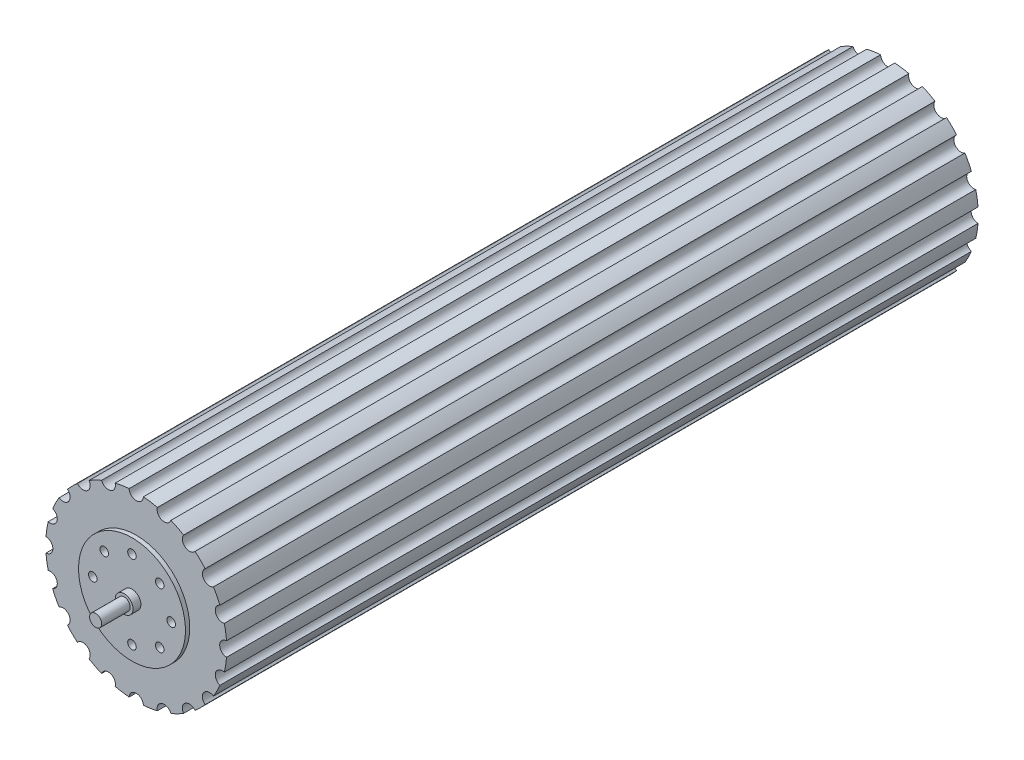
from build123d import *

# Parameters (mm, degrees)
SKETCH1_R               = 127
BOSS_EXTRUDE1_DEPTH     = 527
SKETCH4_R               = 12.5
BOSS_EXTRUDE3_DEPTH     = 584
BOSS_EXTRUDE4_START     = 6
SKETCH5_R               = 75
SKETCH5_R_2             = 12.5
BOSS_EXTRUDE4_DEPTH     = 6
CUT_EXTRUDE1_DEPTH      = 1132.347426744
CUT_EXTRUDE1_DEPTH_BACK = 1132.347426744
SKETCH6_R               = 6
CUT_EXTRUDE2_DEPTH      = 1126.42392013
CUT_EXTRUDE2_DEPTH_BACK = 1126.42392013
SKETCH7_R               = 10
SKETCH8_R               = 12.5
SKETCH8_R_2             = 8.5
CUT_EXTRUDE4_DEPTH      = 40
CUT_EXTRUDE5_START      = -40
SKETCH10_R              = 12.5
SKETCH10_R_2            = 8.5
CUT_EXTRUDE5_DEPTH      = 40


with BuildPart() as part:
    # Sketch1 → Boss-Extrude1 (new, symmetric)
    with BuildSketch(Plane.XY):
        Circle(SKETCH1_R)
    extrude(amount=BOSS_EXTRUDE1_DEPTH, both=True)

    # Sketch4 → Boss-Extrude3 (add, symmetric)
    with BuildSketch(Plane(origin=(0, 0, 0), x_dir=(-1, 0, 0), z_dir=(0, 0, -1))):
        with Locations(Location((0, 0, 0), (0, 0, 180))):
            Circle(SKETCH4_R)
    boss_extrude3 = extrude(amount=BOSS_EXTRUDE3_DEPTH, both=True)

    # Sketch5 → Boss-Extrude4 (add)
    with BuildSketch(Plane(origin=(0, 0, -527), x_dir=(-1, 0, 0), z_dir=(0, 0, -1)).offset(BOSS_EXTRUDE4_START)):
        with Locations(Location((0, 0, 0), (0, 0, 180))):
            Circle(SKETCH5_R)
        with Locations(Location((0, 0, 0), (0, 0, 180))):
            Circle(SKETCH5_R_2, mode=Mode.SUBTRACT)
    boss_extrude4 = extrude(amount=-BOSS_EXTRUDE4_DEPTH)

    # Mirror1: Boss-Extrude3, Boss-Extrude4 across plane
    add(boss_extrude3.mirror(Plane(origin=(0, 0, 0), x_dir=(1, 0, 0), z_dir=(0, 0, -1))))
    add(boss_extrude4.mirror(Plane(origin=(0, 0, 0), x_dir=(1, 0, 0), z_dir=(0, 0, -1))))

    # Sketch6 → Cut-Extrude1 (cut, two sides: drawn at the far end of the back side and taken through both)
    with BuildSketch(Plane(origin=(0, 0, -533), x_dir=(-1, 0, 0), z_dir=(0, 0, -1)).offset(-CUT_EXTRUDE1_DEPTH_BACK)):
        with Locations((0, 55)):
            Circle(SKETCH6_R)
        with Locations((38.890872965, 38.890872965)):
            Circle(SKETCH6_R)
        with Locations((55, 0)):
            Circle(SKETCH6_R)
        with Locations((38.890872965, -38.890872965)):
            Circle(SKETCH6_R)
        with Locations((0, -55)):
            Circle(SKETCH6_R)
        with Locations((-38.890872965, -38.890872965)):
            Circle(SKETCH6_R)
        with Locations((-55, 0)):
            Circle(SKETCH6_R)
        with Locations((-38.890872965, 38.890872965)):
            Circle(SKETCH6_R)
    extrude(amount=CUT_EXTRUDE1_DEPTH + CUT_EXTRUDE1_DEPTH_BACK, mode=Mode.SUBTRACT)

    # Sketch7 → Cut-Extrude2 (cut, two sides: drawn at the far end of the back side and taken through both)
    with BuildSketch(Plane(origin=(0, 0, -527), x_dir=(-1, 0, 0), z_dir=(0, 0, -1)).offset(-CUT_EXTRUDE2_DEPTH_BACK)):
        with Locations((0, 127)):
            Circle(SKETCH7_R)
        with Locations((39.245158286, 120.784177569)):
            Circle(SKETCH7_R)
        with Locations((74.648727041, 102.745158286)):
            Circle(SKETCH7_R)
        with Locations((102.745158286, 74.648727041)):
            Circle(SKETCH7_R)
        with Locations((120.784177569, 39.245158286)):
            Circle(SKETCH7_R)
        with Locations((127, 0)):
            Circle(SKETCH7_R)
        with Locations((120.784177569, -39.245158286)):
            Circle(SKETCH7_R)
        with Locations((102.745158286, -74.648727041)):
            Circle(SKETCH7_R)
        with Locations((74.648727041, -102.745158286)):
            Circle(SKETCH7_R)
        with Locations((39.245158286, -120.784177569)):
            Circle(SKETCH7_R)
        with Locations((0, -127)):
            Circle(SKETCH7_R)
        with Locations((-39.245158286, -120.784177569)):
            Circle(SKETCH7_R)
        with Locations((-74.648727041, -102.745158286)):
            Circle(SKETCH7_R)
        with Locations((-102.745158286, -74.648727041)):
            Circle(SKETCH7_R)
        with Locations((-120.784177569, -39.245158286)):
            Circle(SKETCH7_R)
        with Locations((-127, 0)):
            Circle(SKETCH7_R)
        with Locations((-120.784177569, 39.245158286)):
            Circle(SKETCH7_R)
        with Locations((-102.745158286, 74.648727041)):
            Circle(SKETCH7_R)
        with Locations((-74.648727041, 102.745158286)):
            Circle(SKETCH7_R)
        with Locations((-39.245158286, 120.784177569)):
            Circle(SKETCH7_R)
    extrude(amount=CUT_EXTRUDE2_DEPTH + CUT_EXTRUDE2_DEPTH_BACK, mode=Mode.SUBTRACT)

    # Sketch8 → Cut-Extrude4 (cut)
    with BuildSketch(Plane(origin=(0, 0, -584), x_dir=(-1, 0, 0), z_dir=(0, 0, -1))):
        Circle(SKETCH8_R)
        Circle(SKETCH8_R_2, mode=Mode.SUBTRACT)
    extrude(amount=-CUT_EXTRUDE4_DEPTH, mode=Mode.SUBTRACT)

    # Sketch10 → Cut-Extrude5 (cut)
    with BuildSketch(Plane.XY.offset(584).offset(CUT_EXTRUDE5_START)):
        Circle(SKETCH10_R)
        with Locations(Location((0, 0, 0), (0, 0, 180))):
            Circle(SKETCH10_R_2, mode=Mode.SUBTRACT)
    extrude(amount=CUT_EXTRUDE5_DEPTH, mode=Mode.SUBTRACT)


solid = part.part
